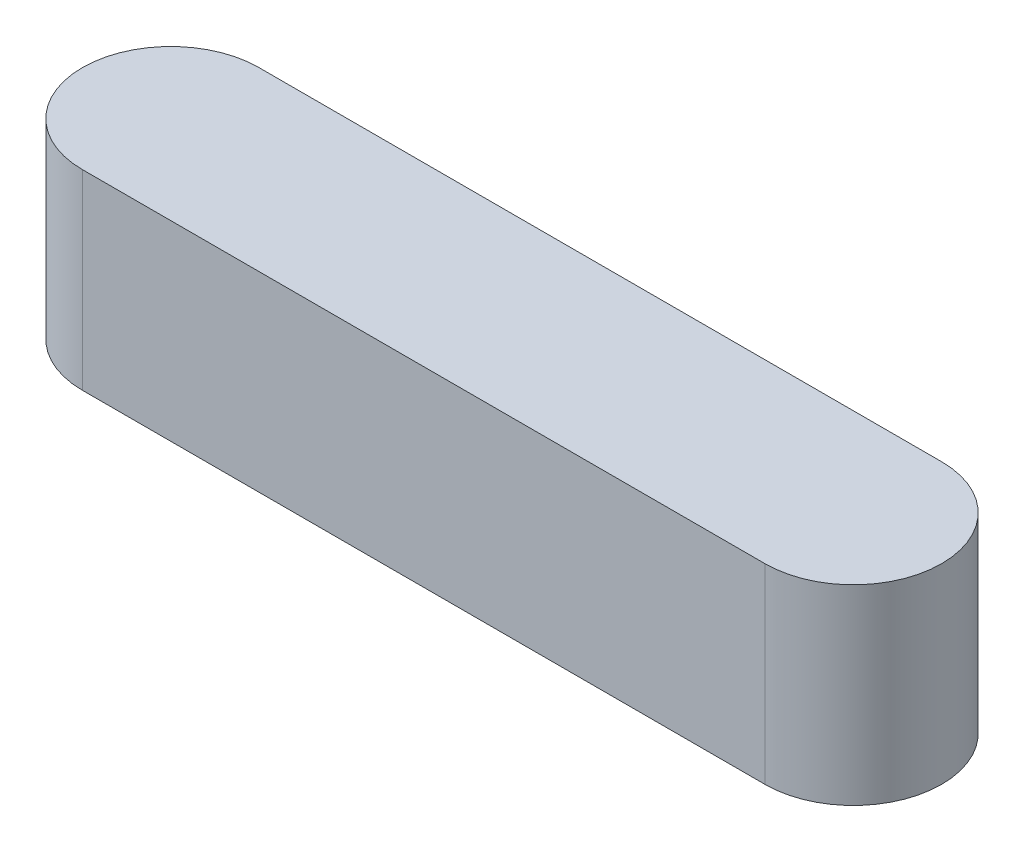
from build123d import *

# Parameters (mm, degrees)
BOSS_EXTRUDE1_DEPTH      = 2
BOSS_EXTRUDE1_DEPTH_BACK = 5


with BuildPart() as part:
    # Sketch1 → Boss-Extrude1 (new, two sides: drawn at the far end of the back side and taken through both)
    with BuildSketch(Plane(origin=(0, 0, 0), x_dir=(1, 0, 0), z_dir=(0, 1, 0)).offset(-BOSS_EXTRUDE1_DEPTH_BACK)):
        with BuildLine():
            Line((-17.253119189, 3.284094305), (7.746880811, 3.284094305))
            ThreePointArc((7.746880811, 3.284094305), (10.980975111, 0.050000005), (7.746880811, -3.184094295))
            Line((7.746880811, -3.184094295), (-17.253119189, -3.184094295))
            ThreePointArc((-17.253119189, -3.184094295), (-20.487213489, 0.050000005), (-17.253119189, 3.284094305))
        make_face()
    extrude(amount=BOSS_EXTRUDE1_DEPTH + BOSS_EXTRUDE1_DEPTH_BACK)


solid = part.part
